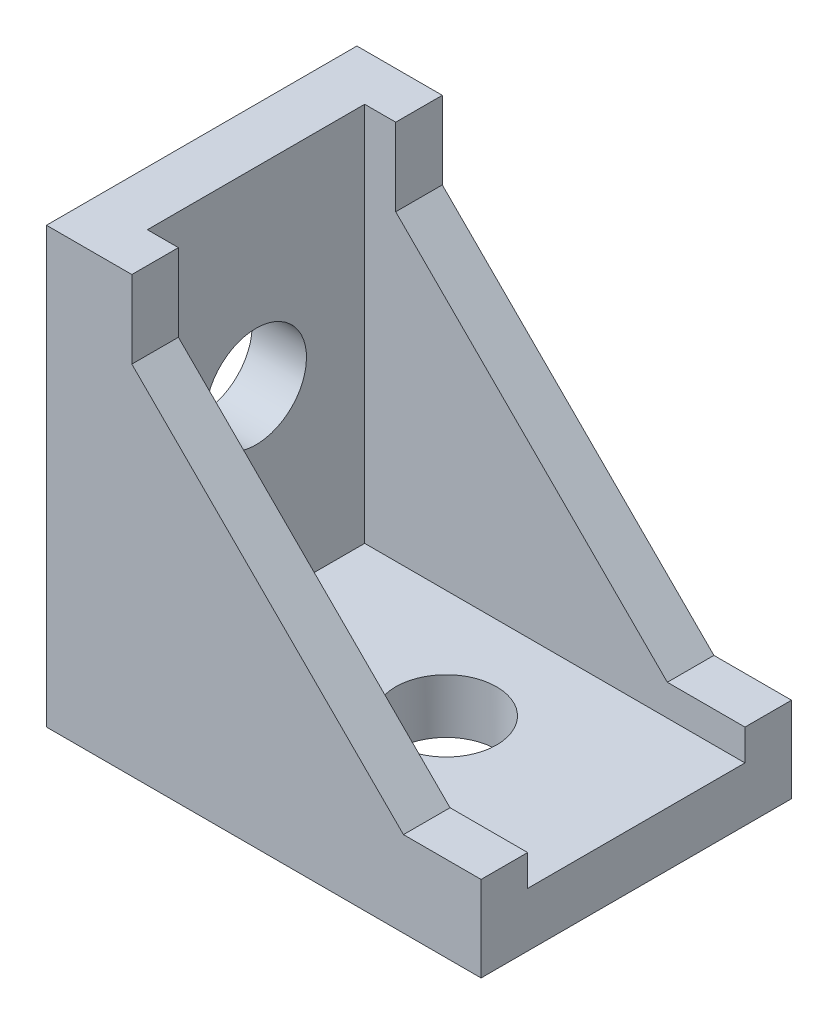
from build123d import *

# Parameters (mm, degrees)
BOSS_EXTRUDE1_DEPTH     = 10
BOSS_EXTRUDE2_DEPTH     = 3
CUT_EXTRUDE1_DEPTH      = 39.52596527
CUT_EXTRUDE1_DEPTH_BACK = 39.52596527
CUT_EXTRUDE2_DEPTH      = 39.52596527


with BuildPart() as part:
    # Sketch1 → Boss-Extrude1 (new, symmetric)
    with BuildSketch(Plane.XY):
        Polygon((0, 0), (0, 28), (3.5, 28), (3.5, 3.5), (28, 3.5), (28, 0), align=None)
    extrude(amount=BOSS_EXTRUDE1_DEPTH, both=True)

    # Sketch2 → Boss-Extrude2 (add)
    with BuildSketch(Plane.XY.offset(10)):
        Polygon((28, 5.5), (28, 3.5), (3.5, 3.5), (3.5, 28), (5.5, 28), (5.5, 23), (23, 5.5), align=None)
    boss_extrude2 = extrude(amount=-BOSS_EXTRUDE2_DEPTH)

    # Mirror1: Boss-Extrude2 across plane
    add(boss_extrude2.mirror(Plane.XY))

    # Sketch3 → Cut-Extrude1 (cut, two sides: drawn at the far end of the back side and taken through both)
    with BuildSketch(Plane(origin=(0, 3.5, 0), x_dir=(1, 0, 0), z_dir=(0, 1, 0)).offset(-CUT_EXTRUDE1_DEPTH_BACK)):
        with BuildLine():
            ThreePointArc((19, 0), (16.584170789, 3.141123858), (12.928209788, 1.61245155))
            Line((12.928209788, 1.61245155), (18.571790212, -1.61245155))
            ThreePointArc((18.571790212, -1.61245155), (18.891123858, -0.834170789), (19, 0))
        make_face()
        with BuildLine():
            Line((18.571790212, -1.61245155), (12.928209788, 1.61245155))
            ThreePointArc((12.928209788, 1.61245155), (14.13754845, -2.821790212), (18.571790212, -1.61245155))
        make_face()
    extrude(amount=CUT_EXTRUDE1_DEPTH + CUT_EXTRUDE1_DEPTH_BACK, mode=Mode.SUBTRACT)

    # Sketch4 → Cut-Extrude2 (cut, through all)
    with BuildSketch(Plane(origin=(3.5, 0, 0), x_dir=(0, 0, -1), z_dir=(1, 0, 0))):
        with BuildLine():
            ThreePointArc((3.25, 15.75), (2.810957803, 17.381262159), (1.61245155, 18.571790212))
            Line((1.61245155, 18.571790212), (-1.61245155, 12.928209788))
            ThreePointArc((-1.61245155, 12.928209788), (1.631262159, 12.939042197), (3.25, 15.75))
        make_face()
        with BuildLine():
            Line((-1.61245155, 12.928209788), (1.61245155, 18.571790212))
            ThreePointArc((1.61245155, 18.571790212), (-2.821790212, 17.36245155), (-1.61245155, 12.928209788))
        make_face()
    extrude(amount=-CUT_EXTRUDE2_DEPTH, mode=Mode.SUBTRACT)


solid = part.part
